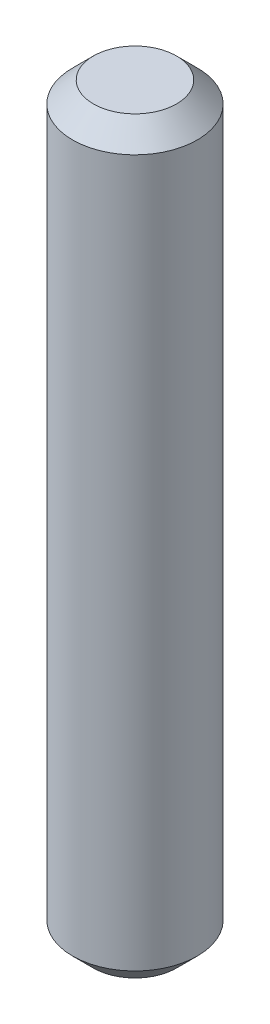
from build123d import *

# Parameters (mm, degrees)
SKETCH_2_R      = 1.5
EXTRUDE_1_DEPTH = 18
CHAMFER_1_SIZE  = 0.5


with BuildPart() as part:
    # Эскиз2 → Бобышка-Вытянуть1 (new body)
    with BuildSketch(Plane(origin=(0, 0, 0), x_dir=(1, 0, 0), z_dir=(0, 1, 0))):
        with Locations(Location((0, 0, 0), (0, 0, 270))):
            Circle(SKETCH_2_R)
    extrude(amount=EXTRUDE_1_DEPTH)

    # Фаска1
    chamfer_1_edges = [part.edges().sort_by_distance(p)[0] for p in [
        (0, 0, -1.5),
        (0, 18, -1.5),
    ]]
    chamfer(chamfer_1_edges, length=CHAMFER_1_SIZE)


solid = part.part
